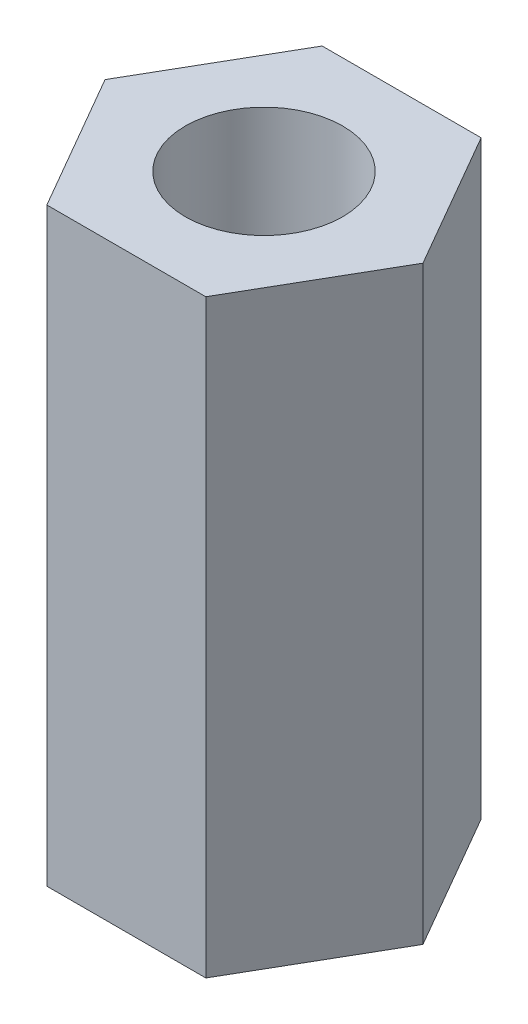
from build123d import *

# Parameters (mm, degrees)
SKETCH_1_R      = 2
EXTRUDE_1_DEPTH = 15


with BuildPart() as part:
    # 草图1 → 凸台-拉伸1 (new body)
    with BuildSketch(Plane(origin=(0, 0, 0), x_dir=(1, 0, 0), z_dir=(0, 1, 0))):
        Polygon((4.041451884, 0), (2.020725942, 3.5), (-2.020725942, 3.5), (-4.041451884, 0), (-2.020725942, -3.5), (2.020725942, -3.5), align=None)
        with Locations(Location((0, 0, 0), (0, 0, 270))):
            Circle(SKETCH_1_R, mode=Mode.SUBTRACT)
    extrude(amount=EXTRUDE_1_DEPTH)


solid = part.part
